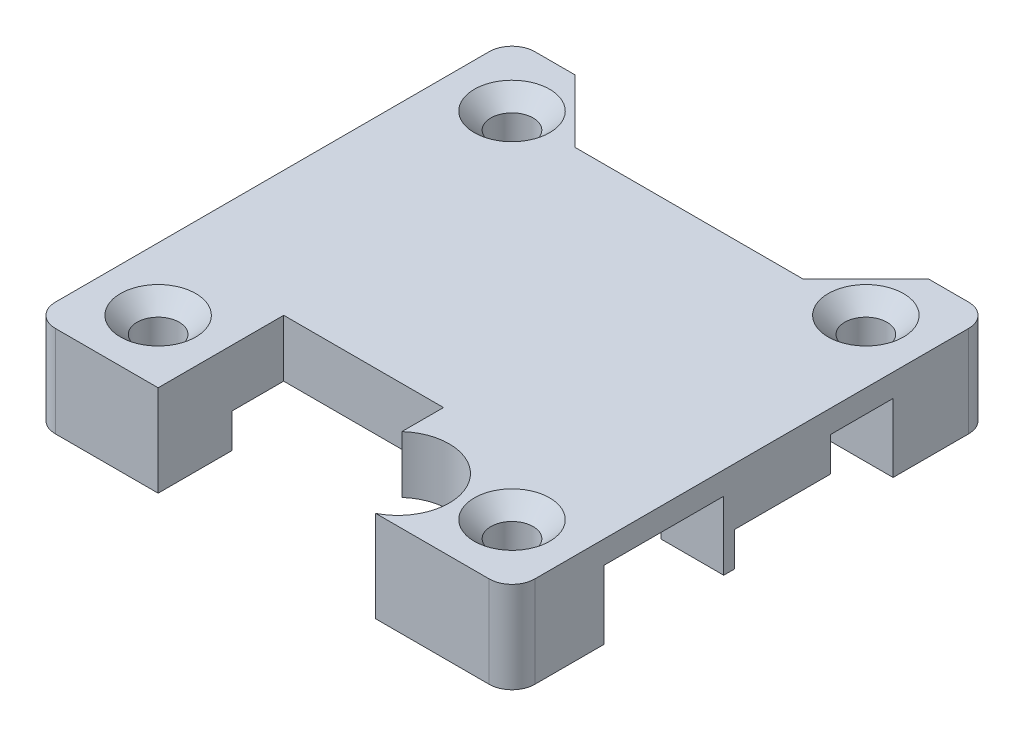
from build123d import *

# Parameters (mm, degrees)
SKETCH_1_W                = 42
SKETCH_1_H                = 42
SKETCH_1_R                = 1.85
EXTRUDE_1_DEPTH           = 8
FILLET_2_R                = 2
FILLET_3_R                = 2
FILLET_4_R                = 2
FILLET_5_R                = 2
SKETCH_2_W                = 6
SKETCH_2_H                = 10.5
SKETCH_2_W_2              = 4
SKETCH_2_H_2              = 26
SKETCH_2_W_3              = 13
SKETCH_2_H_3              = 5.5
CUT_EXTRUDE_1_DEPTH       = 6
SKETCH_3_W                = 5.557975162
SKETCH_3_H                = 9
CUT_EXTRUDE_2_DEPTH       = 3
CUT_EXTRUDE_3_DEPTH       = 31.757112998
CUT_EXTRUDE_13_DEPTH      = 31.757112998
SKETCH_6_W                = 14
SKETCH_6_H                = 11
CUT_EXTRUDE_4_DEPTH       = 31.757112998
CUT_EXTRUDE_5_DEPTH       = 3
HOLE_WIZARD_2_D           = 3.6
HOLE_WIZARD_2_DEPTH       = 8
HOLE_WIZARD_2_CSINK_D     = 6.6
HOLE_WIZARD_2_CSINK_ANGLE = 90


with BuildPart() as part:
    # 草图1 → 凸台-拉伸1 (new body)
    with BuildSketch(Plane(origin=(0, 0, 0), x_dir=(1, 0, 0), z_dir=(0, 1, 0))):
        Rectangle(SKETCH_1_W, SKETCH_1_H)
        with Locations(Location((15.5, 15.5, 0), (0, 0, 270))):
            Circle(SKETCH_1_R, mode=Mode.SUBTRACT)
        with Locations(Location((-15.5, 15.5, 0), (0, 0, 270))):
            Circle(SKETCH_1_R, mode=Mode.SUBTRACT)
        with Locations(Location((-15.5, -15.5, 0), (0, 0, 270))):
            Circle(SKETCH_1_R, mode=Mode.SUBTRACT)
        with Locations(Location((15.5, -15.5, 0), (0, 0, 270))):
            Circle(SKETCH_1_R, mode=Mode.SUBTRACT)
    extrude(amount=EXTRUDE_1_DEPTH)

    # 圆角2
    fillet_2_edges = [part.edges().sort_by_distance(p)[0] for p in [
        (-21, 4, -21),
    ]]
    fillet(fillet_2_edges, radius=FILLET_2_R)

    # 圆角3
    fillet_3_edges = [part.edges().sort_by_distance(p)[0] for p in [
        (-21, 4, 21),
    ]]
    fillet(fillet_3_edges, radius=FILLET_3_R)

    # 圆角4
    fillet_4_edges = [part.edges().sort_by_distance(p)[0] for p in [
        (21, 4, 21),
    ]]
    fillet(fillet_4_edges, radius=FILLET_4_R)

    # 圆角5
    fillet_5_edges = [part.edges().sort_by_distance(p)[0] for p in [
        (21, 4, -21),
    ]]
    fillet(fillet_5_edges, radius=FILLET_5_R)

    # 草图2 → 切除-拉伸1 (cut)
    with BuildSketch(Plane.XZ):
        with Locations((18, 7.7)):
            Rectangle(SKETCH_2_W, SKETCH_2_H)
        with Locations((-19, -0.23)):
            Rectangle(SKETCH_2_W_2, SKETCH_2_H_2)
        with Locations((14.5, -9.635)):
            Rectangle(SKETCH_2_W_3, SKETCH_2_H_3)
    extrude(amount=-CUT_EXTRUDE_1_DEPTH, mode=Mode.SUBTRACT)

    # 草图3 → 切除-拉伸2 (cut)
    with BuildSketch(Plane.XZ):
        with Locations((18.221012419, -3)):
            Rectangle(SKETCH_3_W, SKETCH_3_H)
    extrude(amount=-CUT_EXTRUDE_2_DEPTH, mode=Mode.SUBTRACT)

    # 草图5 → 切除-拉伸3 (cut, through all)
    with BuildSketch(Plane.XZ):
        Polygon((-15.5, -21), (-10, -15.5), (10, -15.5), (15.5, -21), align=None)
    extrude(amount=-CUT_EXTRUDE_3_DEPTH, mode=Mode.SUBTRACT)

    # 草图10 → 切除-拉伸13 (cut, through all)
    with BuildSketch(Plane(origin=(0, 8, 0), x_dir=(1, 0, 0), z_dir=(0, 1, 0))):
        with BuildLine():
            Line((7, -21.5), (2.5, -21.5))
            Line((2.5, -21.5), (2.5, -17))
            ThreePointArc((2.5, -17), (10.181980515, -13.818019485), (7, -21.5))
        make_face()
    extrude(amount=-CUT_EXTRUDE_13_DEPTH, mode=Mode.SUBTRACT)

    # 草图6 → 切除-拉伸4 (cut, through all)
    with BuildSketch(Plane.XZ):
        with Locations((-3, 15.5)):
            Rectangle(SKETCH_6_W, SKETCH_6_H)
    extrude(amount=-CUT_EXTRUDE_4_DEPTH, mode=Mode.SUBTRACT)

    # 草图7 → 切除-拉伸5 (cut)
    with BuildSketch(Plane.XZ):
        Polygon((-9.016278831, 15.5), (-15.5, 9.016278831), (-15.5, -9.016278831), (-9.016278831, -15.5), (9.016278831, -15.5), (15.5, -9.016278831), (15.5, 9.016278831), (9.016278831, 15.5), align=None)
    extrude(amount=-CUT_EXTRUDE_5_DEPTH, mode=Mode.SUBTRACT)

    # 打孔尺寸(%根据十字)槽半沉头木螺钉的类型2
    with Locations(Plane(origin=(0, 8, 0), x_dir=(1, 0, 0), z_dir=(0, 1, 0))):
        with Locations((15.5, -15.5), (-15.5, -15.5), (-15.5, 15.5), (15.5, 15.5)):
            CounterSinkHole(HOLE_WIZARD_2_D / 2, HOLE_WIZARD_2_CSINK_D / 2, depth=HOLE_WIZARD_2_DEPTH, counter_sink_angle=HOLE_WIZARD_2_CSINK_ANGLE)


solid = part.part
